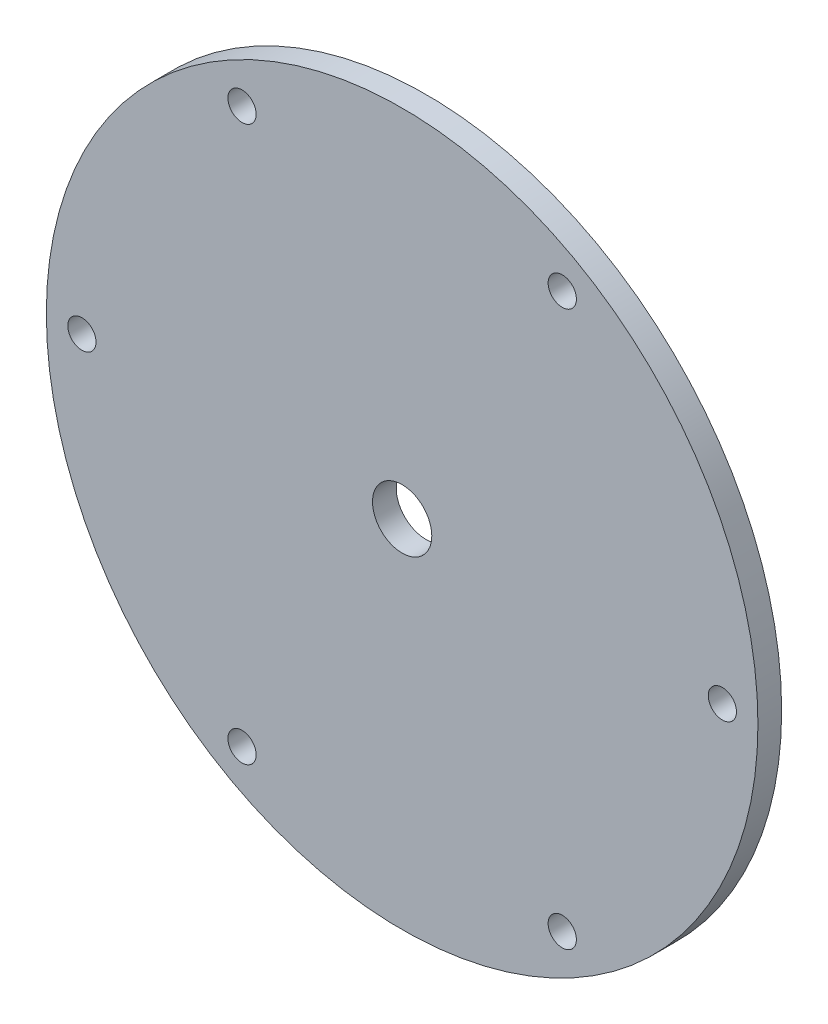
from build123d import *

# Parameters (mm, degrees)
SKETCH1_R                   = 60
SKETCH1_R_2                 = 5
BOSS_EXTRUDE1_DEPTH         = 4
F_3_16_0_1875_DOWEL_HOLE1_D = 4.7625


with BuildPart() as part:
    # Sketch1 → Boss-Extrude1 (new body)
    with BuildSketch(Plane.XY):
        Circle(SKETCH1_R)
        Circle(SKETCH1_R_2, mode=Mode.SUBTRACT)
    extrude(amount=BOSS_EXTRUDE1_DEPTH)

    # 3/16 (0.1875) Dowel Hole1 (through all)
    with Locations(Plane(origin=(-54, 0, 4), x_dir=(1, 0, 0), z_dir=(0, 0, 1))):
        with Locations((0, 0), (108, 0), (27, 46.765371804), (27, -46.765371804), (81, 46.765371804), (81, -46.765371804)):
            Hole(F_3_16_0_1875_DOWEL_HOLE1_D / 2)


solid = part.part
